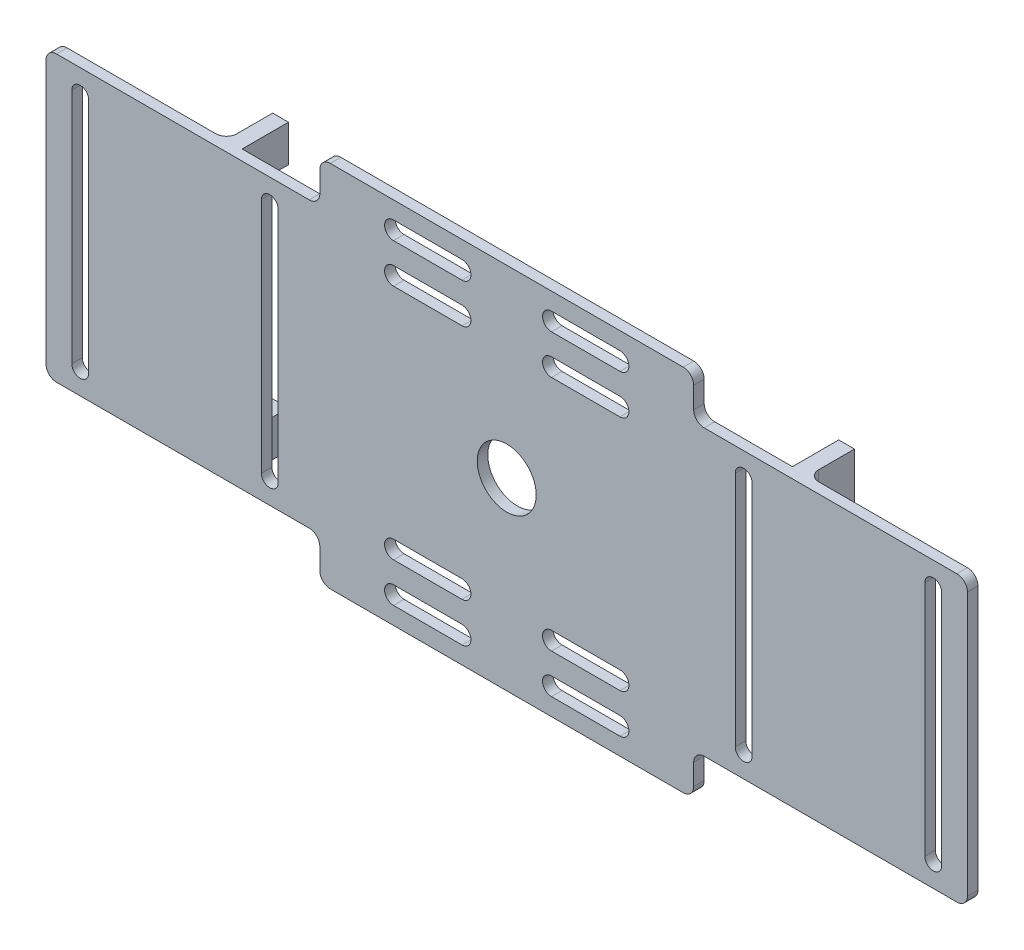
from build123d import *

# Parameters (mm, degrees)
EXTRUDE_1_DEPTH     = 2
SKETCH_2_R          = 5.6
CUT_EXTRUDE_1_DEPTH = 95.26160406
SKETCH_5_W          = 3
SKETCH_5_H          = 54
EXTRUDE_2_DEPTH     = 10.8
FILLET_1_R          = 2
SKETCH_6_W          = 3
SKETCH_6_H          = 40
CUT_EXTRUDE_3_DEPTH = 6
FILLET_2_R          = 2
FILLET_3_R          = 2


with BuildPart() as part:
    # 草圖1 → 填料-伸長1 (new body)
    with BuildSketch(Plane.XY):
        with BuildLine():
            Line((35.5, 33), (35.5, 29))
            ThreePointArc((35.5, 29), (36.085786438, 27.585786438), (37.5, 27))
            Line((37.5, 27), (85.5, 27))
            ThreePointArc((85.5, 27), (86.914213562, 26.414213562), (87.5, 25))
            Line((87.5, 25), (87.5, -25))
            ThreePointArc((87.5, -25), (86.914213562, -26.414213562), (85.5, -27))
            Line((85.5, -27), (37.5, -27))
            ThreePointArc((37.5, -27), (36.085786438, -27.585786438), (35.5, -29))
            Line((35.5, -29), (35.5, -33))
            ThreePointArc((35.5, -33), (34.914213562, -34.414213562), (33.5, -35))
            Line((33.5, -35), (-33.5, -35))
            ThreePointArc((-33.5, -35), (-34.914213562, -34.414213562), (-35.5, -33))
            Line((-35.5, -33), (-35.5, -29))
            ThreePointArc((-35.5, -29), (-36.085786438, -27.585786438), (-37.5, -27))
            Line((-37.5, -27), (-85.5, -27))
            ThreePointArc((-85.5, -27), (-86.914213562, -26.414213562), (-87.5, -25))
            Line((-87.5, -25), (-87.5, 25))
            ThreePointArc((-87.5, 25), (-86.914213562, 26.414213562), (-85.5, 27))
            Line((-85.5, 27), (-37.5, 27))
            ThreePointArc((-37.5, 27), (-36.085786438, 27.585786438), (-35.5, 29))
            Line((-35.5, 29), (-35.5, 33))
            ThreePointArc((-35.5, 33), (-34.914213562, 34.414213562), (-33.5, 35))
            Line((-33.5, 35), (33.5, 35))
            ThreePointArc((33.5, 35), (34.914213562, 34.414213562), (35.5, 33))
        make_face()
    extrude(amount=EXTRUDE_1_DEPTH)

    # 草圖2 → 除料-伸長1 (cut, through all)
    with BuildSketch(Plane.XY.offset(2)):
        Circle(SKETCH_2_R)
        with BuildLine():
            Line((43.4, -22.5), (43.4, 22.5))
            ThreePointArc((43.4, 22.5), (45, 24.1), (46.6, 22.5))
            Line((46.6, 22.5), (46.6, -22.5))
            ThreePointArc((46.6, -22.5), (45, -24.1), (43.4, -22.5))
        make_face()
        with BuildLine():
            Line((-46.6, -22.5), (-46.6, 22.5))
            ThreePointArc((-46.6, 22.5), (-45, 24.1), (-43.4, 22.5))
            Line((-43.4, 22.5), (-43.4, -22.5))
            ThreePointArc((-43.4, -22.5), (-45, -24.1), (-46.6, -22.5))
        make_face()
        with BuildLine():
            Line((21.5, 28.3), (8.5, 28.3))
            ThreePointArc((8.5, 28.3), (6.8, 30), (8.5, 31.7))
            Line((8.5, 31.7), (21.5, 31.7))
            ThreePointArc((21.5, 31.7), (23.2, 30), (21.5, 28.3))
        make_face()
        with BuildLine():
            Line((-82.6, -22.5), (-82.6, 22.5))
            ThreePointArc((-82.6, 22.5), (-81, 24.1), (-79.4, 22.5))
            Line((-79.4, 22.5), (-79.4, -22.5))
            ThreePointArc((-79.4, -22.5), (-81, -24.1), (-82.6, -22.5))
        make_face()
        with BuildLine():
            Line((79.4, -22.5), (79.4, 22.5))
            ThreePointArc((79.4, 22.5), (81, 24.1), (82.6, 22.5))
            Line((82.6, 22.5), (82.6, -22.5))
            ThreePointArc((82.6, -22.5), (81, -24.1), (79.4, -22.5))
        make_face()
        with BuildLine():
            Line((21.5, 20.8), (8.5, 20.8))
            ThreePointArc((8.5, 20.8), (6.8, 22.5), (8.5, 24.2))
            Line((8.5, 24.2), (21.5, 24.2))
            ThreePointArc((21.5, 24.2), (23.2, 22.5), (21.5, 20.8))
        make_face()
        with BuildLine():
            Line((-21.5, 28.3), (-8.5, 28.3))
            ThreePointArc((-8.5, 28.3), (-6.8, 30), (-8.5, 31.7))
            Line((-8.5, 31.7), (-21.5, 31.7))
            ThreePointArc((-21.5, 31.7), (-23.2, 30), (-21.5, 28.3))
        make_face()
        with BuildLine():
            Line((-21.5, 20.8), (-8.5, 20.8))
            ThreePointArc((-8.5, 20.8), (-6.8, 22.5), (-8.5, 24.2))
            Line((-8.5, 24.2), (-21.5, 24.2))
            ThreePointArc((-21.5, 24.2), (-23.2, 22.5), (-21.5, 20.8))
        make_face()
        with BuildLine():
            Line((21.5, -28.3), (8.5, -28.3))
            ThreePointArc((8.5, -28.3), (6.8, -30), (8.5, -31.7))
            Line((8.5, -31.7), (21.5, -31.7))
            ThreePointArc((21.5, -31.7), (23.2, -30), (21.5, -28.3))
        make_face()
        with BuildLine():
            Line((21.5, -20.8), (8.5, -20.8))
            ThreePointArc((8.5, -20.8), (6.8, -22.5), (8.5, -24.2))
            Line((8.5, -24.2), (21.5, -24.2))
            ThreePointArc((21.5, -24.2), (23.2, -22.5), (21.5, -20.8))
        make_face()
        with BuildLine():
            Line((-21.5, -28.3), (-8.5, -28.3))
            ThreePointArc((-8.5, -28.3), (-6.8, -30), (-8.5, -31.7))
            Line((-8.5, -31.7), (-21.5, -31.7))
            ThreePointArc((-21.5, -31.7), (-23.2, -30), (-21.5, -28.3))
        make_face()
        with BuildLine():
            Line((-21.5, -20.8), (-8.5, -20.8))
            ThreePointArc((-8.5, -20.8), (-6.8, -22.5), (-8.5, -24.2))
            Line((-8.5, -24.2), (-21.5, -24.2))
            ThreePointArc((-21.5, -24.2), (-23.2, -22.5), (-21.5, -20.8))
        make_face()
    extrude(amount=-CUT_EXTRUDE_1_DEPTH, mode=Mode.SUBTRACT)

    # 草圖5 → 填料-伸長2 (add)
    with BuildSketch(Plane.XY.offset(2)):
        with Locations((-53.75, 0)):
            Rectangle(SKETCH_5_W, SKETCH_5_H)
        with Locations((53.75, 0)):
            Rectangle(SKETCH_5_W, SKETCH_5_H)
    extrude(amount=-EXTRUDE_2_DEPTH)

    # 圓角1
    fillet_1_edges = [part.edges().sort_by_distance(p)[0] for p in [
        (55.25, 0, 0),
    ]]
    fillet(fillet_1_edges, radius=FILLET_1_R)

    # 草圖6 → 除料-伸長3 (cut)
    with BuildSketch(Plane(origin=(0, 0, -8.8), x_dir=(-1, 0, 0), z_dir=(0, 0, -1))):
        with Locations((53.75, 0)):
            Rectangle(SKETCH_6_W, SKETCH_6_H)
    extrude(amount=-CUT_EXTRUDE_3_DEPTH, mode=Mode.SUBTRACT)

    # 圓角2
    fillet_2_edges = [part.edges().sort_by_distance(p)[0] for p in [
        (-53.75, -20, -2.8),
        (-53.75, 20, -2.8),
    ]]
    fillet(fillet_2_edges, radius=FILLET_2_R)

    # 圓角3
    fillet_3_edges = [part.edges().sort_by_distance(p)[0] for p in [
        (-55.25, 0, 0),
    ]]
    fillet(fillet_3_edges, radius=FILLET_3_R)


solid = part.part
